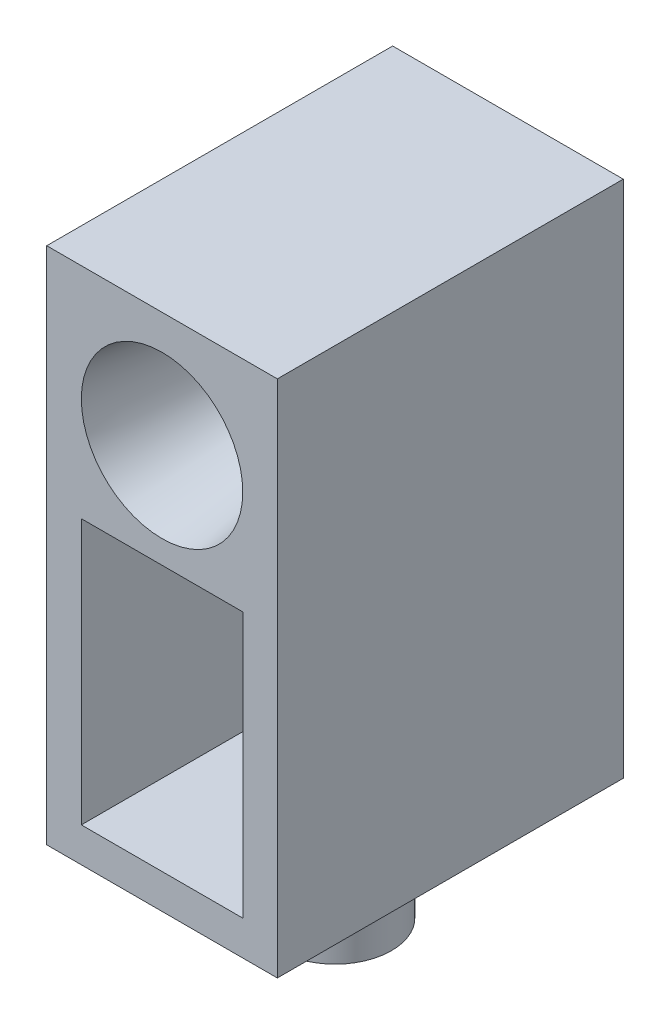
from build123d import *

# Parameters (mm, degrees)
SKETCH1_W           = 20
SKETCH1_H           = 30
BOSS_EXTRUDE1_DEPTH = 45
SKETCH2_R           = 4.9
BOSS_EXTRUDE2_DEPTH = 8
SKETCH3_R           = 7
CUT_EXTRUDE1_DEPTH  = 24
CUT_EXTRUDE1_DRAFT  = -9
SKETCH4_R           = 3.198773432
CUT_EXTRUDE2_DEPTH  = 3
SKETCH5_R           = 0.5
CUT_EXTRUDE3_DEPTH  = 3
SKETCH6_W           = 14
SKETCH6_H           = 23
CUT_EXTRUDE4_DEPTH  = 56


with BuildPart() as part:
    # Sketch1 → Boss-Extrude1 (new body)
    with BuildSketch(Plane(origin=(0, 0, 0), x_dir=(1, 0, 0), z_dir=(0, 1, 0))):
        Rectangle(SKETCH1_W, SKETCH1_H)
    extrude(amount=BOSS_EXTRUDE1_DEPTH)

    # Sketch2 → Boss-Extrude2 (add)
    with BuildSketch(Plane(origin=(0, 0, 0), x_dir=(-1, 0, 0), z_dir=(0, -1, 0))):
        with Locations(Location((0, 0, 0), (0, 0, 90))):
            Circle(SKETCH2_R)
    extrude(amount=BOSS_EXTRUDE2_DEPTH)


with BuildPart() as cut_extrude1_tool:
    # Sketch3 → Cut-Extrude1 (with draft: the straight prism first)
    with BuildSketch(Plane.XY.offset(15)):
        with Locations((0, 35)):
            Circle(SKETCH3_R)
    extrude(amount=-CUT_EXTRUDE1_DEPTH)
    # Cut-Extrude1: the draft: its side faces are tilted about the plane it starts from
    cut_extrude1_sides = [cut_extrude1_tool.faces().sort_by_distance(p)[0] for p in [
        (-7, 35, 3),
    ]]
    draft(cut_extrude1_sides, Plane.XY.offset(15), CUT_EXTRUDE1_DRAFT)


with BuildPart() as part_1:
    add(part.part)

    # Cut-Extrude1: cut by cut_extrude1_tool
    add(cut_extrude1_tool.part, mode=Mode.SUBTRACT)

    # Sketch4 → Cut-Extrude2 (cut)
    with BuildSketch(Plane.XY.offset(-9)):
        with Locations((0, 35)):
            Circle(SKETCH4_R)
    extrude(amount=-CUT_EXTRUDE2_DEPTH, mode=Mode.SUBTRACT)

    # Sketch5 → Cut-Extrude3 (cut)
    with BuildSketch(Plane.XY.offset(-12)):
        with Locations((-1.5, 35)):
            Circle(SKETCH5_R)
        with Locations((1.5, 35)):
            Circle(SKETCH5_R)
    extrude(amount=-CUT_EXTRUDE3_DEPTH, mode=Mode.SUBTRACT)

    # Sketch6 → Cut-Extrude4 (cut, through all)
    with BuildSketch(Plane.XY.offset(15)):
        with Locations((0, 14.5)):
            Rectangle(SKETCH6_W, SKETCH6_H)
    extrude(amount=-CUT_EXTRUDE4_DEPTH, mode=Mode.SUBTRACT)


solid = part_1.part
